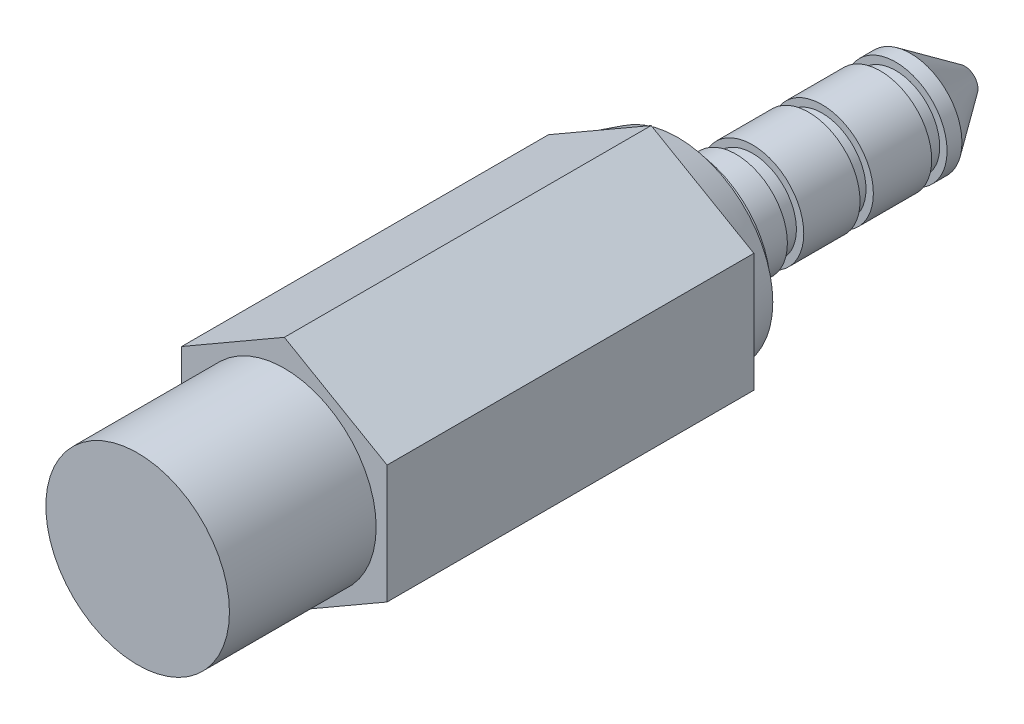
from build123d import *

# Parameters (mm, degrees)
SALIENTE_EXTRUIR1_DEPTH = 25
CROQUIS2_R              = 6.257629611
SALIENTE_EXTRUIR2_DEPTH = 10


with BuildPart() as part:
    # Croquis1 → Saliente-Extruir1 (new body)
    with BuildSketch(Plane.XY):
        Polygon((0, -8.082903769), (7, -4.041451884), (7, 4.041451884), (0, 8.082903769), (-7, 4.041451884), (-7, -4.041451884), align=None)
    extrude(amount=SALIENTE_EXTRUIR1_DEPTH)

    # Croquis2 → Saliente-Extruir2 (add)
    with BuildSketch(Plane.XY.offset(25)):
        Circle(CROQUIS2_R)
    extrude(amount=SALIENTE_EXTRUIR2_DEPTH)

    # Croquis3 → Revolución1 (revolve)
    with BuildSketch(Plane(origin=(0, 0, 0), x_dir=(1, 0, 0), z_dir=(0, 1, 0))):
        Polygon((0, 21.382125591), (0.894479356, 21.382125591), (3.5, 17.682529237), (3.5, 16.666829395), (3, 16.666829395), (3, 15.620463348), (3.5, 15.620463348), (3.5, 11.644272372), (3, 11.644272372), (3, 10.737421798), (3.5, 10.737421798), (3.5, 6.900746294), (3, 6.900746294), (3, 5.784622511), (3.5, 5.784622511), (3.5, 2.645524372), (5.467415644, 2.645524372), (5.467415644, 1.808431535), (6.483115486, 1.808431535), (7, 0), (0, 0), align=None)
    revolve(axis=Axis((0, 0, 0), (0, 0, -1)))


solid = part.part
